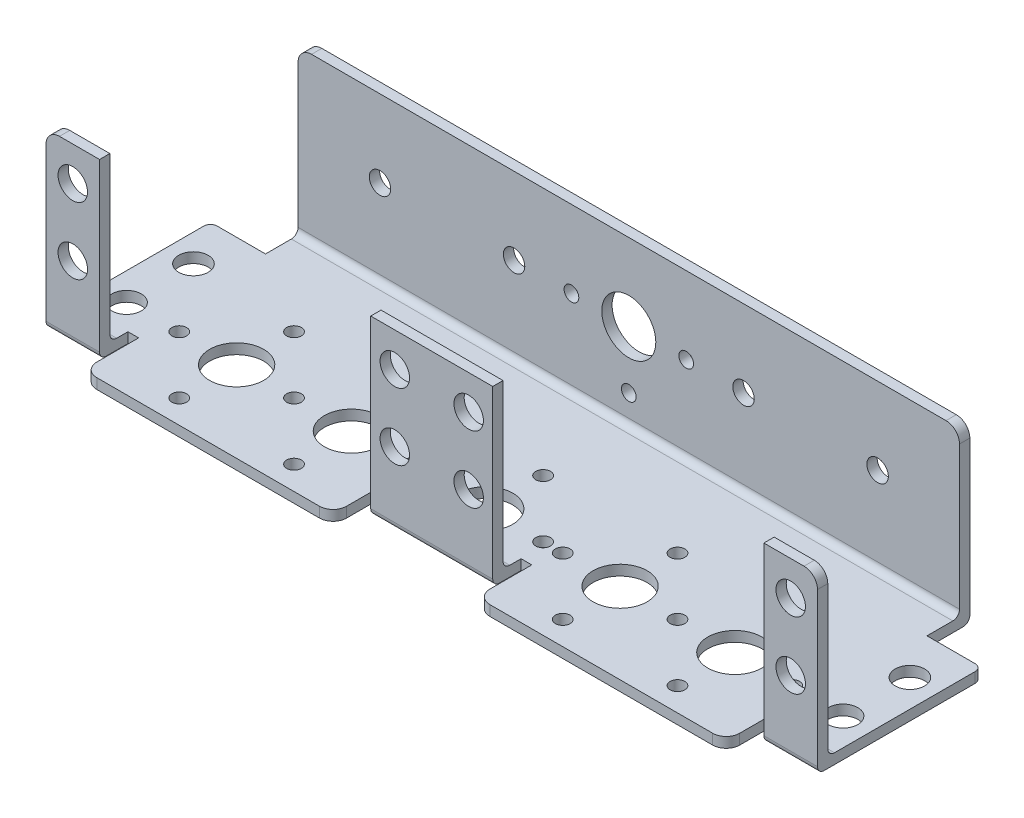
from build123d import *

# Parameters (mm, degrees)
SKETCH1_W               = 114.3
SKETCH1_H               = 34.72
BOSS_EXTRUDE1_DEPTH     = 1.524
SKETCH2_R               = 2.184
SKETCH2_W               = 8.15
SKETCH2_H               = 6.35
CUT_EXTRUDE1_DEPTH      = 1.524
SKETCH3_R               = 4
CUT_EXTRUDE2_DEPTH      = 50
SKETCH4_R               = 1.09
CUT_EXTRUDE3_DEPTH      = 50
CIRPATTERN1_COUNT       = 4
MIRROR2_COPY_1_SKETCH_R = 1.09
MIRROR2_COPY_1_DEPTH    = 50
MIRROR2_COPY_2_SKETCH_R = 1.09
MIRROR2_COPY_2_DEPTH    = 50
MIRROR2_COPY_3_SKETCH_R = 1.09
MIRROR2_COPY_3_DEPTH    = 50
SKETCH7_R               = 4
CUT_EXTRUDE4_DEPTH      = 100
SKETCH8_R               = 1.09
CUT_EXTRUDE5_DEPTH      = 100
CIRPATTERN2_COUNT       = 4
MIRROR3_COPY_1_SKETCH_R = 1.09
MIRROR3_COPY_1_DEPTH    = 50
MIRROR3_COPY_2_SKETCH_R = 1.09
MIRROR3_COPY_2_DEPTH    = 50
MIRROR3_COPY_3_SKETCH_R = 1.09
MIRROR3_COPY_3_DEPTH    = 50
MIRROR3_COPY_4_SKETCH_R = 4
MIRROR3_COPY_4_DEPTH    = 50
MIRROR3_COPY_5_SKETCH_R = 1.09
MIRROR3_COPY_5_DEPTH    = 50
MIRROR3_COPY_6_SKETCH_R = 1.09
MIRROR3_COPY_6_DEPTH    = 50
MIRROR3_COPY_7_SKETCH_R = 1.09
MIRROR3_COPY_7_DEPTH    = 50
MIRROR3_COPY_8_SKETCH_R = 1.09
MIRROR3_COPY_8_DEPTH    = 50
SKETCH9_W               = 7.9375
SKETCH9_H               = 1.524
BOSS_EXTRUDE2_DEPTH     = 24.2
SKETCH10_W              = 98
SKETCH10_H              = 1.524
SKETCH10_W_2            = 18.075
BOSS_EXTRUDE3_DEPTH     = 24.2
SKETCH11_R              = 2.1844
CUT_EXTRUDE6_DEPTH      = 24.2
SKETCH12_R              = 2.1844
CUT_EXTRUDE8_DEPTH      = 24.2
FILLET1_R               = 1
SKETCH13_R              = 1.5875
CUT_EXTRUDE9_DEPTH      = 24.2
FILLET2_R               = 2
SKETCH14_R              = 4
CUT_EXTRUDE10_DEPTH     = 24.2
SKETCH15_R              = 1.09
CUT_EXTRUDE11_DEPTH     = 24.2
CIRPATTERN3_COUNT       = 4


with BuildPart() as part:
    # Sketch1 → Boss-Extrude1 (new body)
    with BuildSketch(Plane(origin=(0, 0, 0), x_dir=(1, 0, 0), z_dir=(0, 1, 0))):
        Rectangle(SKETCH1_W, SKETCH1_H)
    extrude(amount=BOSS_EXTRUDE1_DEPTH)

    # Sketch2 → Cut-Extrude1 (cut)
    with BuildSketch(Plane(origin=(0, 1.524, 0), x_dir=(1, 0, 0), z_dir=(0, 1, 0))):
        with Locations(Location((-53.075, 4.41, 0), (0, 0, 270))):
            Circle(SKETCH2_R)
        with Locations(Location((-53.075, -5.5, 0), (0, 0, 270))):
            Circle(SKETCH2_R)
        with Locations((-53.075, 14.185)):
            Rectangle(SKETCH2_W, SKETCH2_H)
        Polygon((-57.15, -13.36), (-49.2125, -13.36), (-49.2125, -9.16), (-47.625, -9.16), (-47.625, -13.36), (-47.625, -17.36), (-57.15, -17.36), align=None)
        Polygon((-10.625, -13.36), (-10.625, -9.16), (-9.0375, -9.16), (-9.0375, -13.36), (0, -13.36), (0, -17.36), (-10.625, -17.36), align=None)
    cut_extrude1 = extrude(amount=-CUT_EXTRUDE1_DEPTH, mode=Mode.SUBTRACT)

    # Mirror1: Cut-Extrude1 across plane
    add(cut_extrude1.mirror(Plane(origin=(0, 0, 0), x_dir=(0, 0, 1), z_dir=(1, 0, 0))), mode=Mode.SUBTRACT)

    # Sketch3 → Cut-Extrude2 (cut, symmetric)
    with BuildSketch(Plane(origin=(0, 1.524, 0), x_dir=(1, 0, 0), z_dir=(0, 1, 0))):
        with Locations(Location((-36.9062, -5.36, 0), (0, 0, 90))):
            Circle(SKETCH3_R)
    cut_extrude2 = extrude(amount=CUT_EXTRUDE2_DEPTH, both=True, mode=Mode.SUBTRACT)

    # Sketch4 → Cut-Extrude3 (cut, symmetric)
    with BuildSketch(Plane(origin=(0, 1.524, 0), x_dir=(1, 0, 0), z_dir=(0, 1, 0))):
        with Locations(Location((-36.9062, 3.14, 0), (0, 0, 90))):
            Circle(SKETCH4_R)
    cut_extrude3 = extrude(amount=CUT_EXTRUDE3_DEPTH, both=True, mode=Mode.SUBTRACT)

    # CirPattern1: Cut-Extrude3 ×4 about axis
    cirpattern1_axis = Axis((-36.9062, 0, 5.36), (0, 1, 0))
    for i in range(1, CIRPATTERN1_COUNT):
        add(cut_extrude3.rotate(cirpattern1_axis, i * 360 / CIRPATTERN1_COUNT), mode=Mode.SUBTRACT)

    # Mirror2: Cut-Extrude2, Cut-Extrude3 across plane
    add(cut_extrude2.mirror(Plane.ZY.offset(28.4062)), mode=Mode.SUBTRACT)
    add(cut_extrude3.mirror(Plane.ZY.offset(28.4062)), mode=Mode.SUBTRACT)

    # Mirror2 copy 1 sketch → Mirror2 copy 1 (cut, symmetric)
    with BuildSketch(Plane(origin=(-14.5462, 1.524, -31.5462), x_dir=(0, 0, -1), z_dir=(0, 1, 0))):
        with Locations((-36.9062, -3.14)):
            Circle(MIRROR2_COPY_1_SKETCH_R)
    extrude(amount=MIRROR2_COPY_1_DEPTH, both=True, mode=Mode.SUBTRACT)

    # Mirror2 copy 2 sketch → Mirror2 copy 2 (cut, symmetric)
    with BuildSketch(Plane(origin=(17, 1.524, 10.72), x_dir=(1, 0, 0), z_dir=(0, 1, 0))):
        with Locations((-36.9062, -3.14)):
            Circle(MIRROR2_COPY_2_SKETCH_R)
    extrude(amount=MIRROR2_COPY_2_DEPTH, both=True, mode=Mode.SUBTRACT)

    # Mirror2 copy 3 sketch → Mirror2 copy 3 (cut, symmetric)
    with BuildSketch(Plane(origin=(-25.2662, 1.524, 42.2662), x_dir=(0, 0, 1), z_dir=(0, 1, 0))):
        with Locations((-36.9062, -3.14)):
            Circle(MIRROR2_COPY_3_SKETCH_R)
    extrude(amount=MIRROR2_COPY_3_DEPTH, both=True, mode=Mode.SUBTRACT)

    # Sketch7 → Cut-Extrude4 (cut)
    with BuildSketch(Plane(origin=(0, 1.524, 0), x_dir=(1, 0, 0), z_dir=(0, 1, 0))):
        with Locations(Location((0, -5.36, 0), (0, 0, 270))):
            Circle(SKETCH7_R)
    extrude(amount=-CUT_EXTRUDE4_DEPTH, mode=Mode.SUBTRACT)

    # Sketch8 → Cut-Extrude5 (cut)
    with BuildSketch(Plane(origin=(0, 1.524, 0), x_dir=(1, 0, 0), z_dir=(0, 1, 0))):
        with Locations(Location((0, 3.14, 0), (0, 0, 270))):
            Circle(SKETCH8_R)
    cut_extrude5 = extrude(amount=-CUT_EXTRUDE5_DEPTH, mode=Mode.SUBTRACT)

    # CirPattern2: Cut-Extrude5 ×4 about axis, 1 skipped
    cirpattern2_axis = Axis((0, 0, 5.36), (0, 1, 0))
    add([cut_extrude5.rotate(cirpattern2_axis, i * 360 / CIRPATTERN2_COUNT) for i in range(1, CIRPATTERN2_COUNT) if i not in (2,)], mode=Mode.SUBTRACT)

    # Mirror3: Cut-Extrude2, Cut-Extrude3 across plane
    add(cut_extrude2.mirror(Plane(origin=(0, 0, 0), x_dir=(0, 0, 1), z_dir=(1, 0, 0))), mode=Mode.SUBTRACT)
    add(cut_extrude3.mirror(Plane(origin=(0, 0, 0), x_dir=(0, 0, 1), z_dir=(1, 0, 0))), mode=Mode.SUBTRACT)

    # Mirror3 copy 1 sketch → Mirror3 copy 1 (cut, symmetric)
    with BuildSketch(Plane(origin=(42.2662, 1.524, -31.5462), x_dir=(0, 0, -1), z_dir=(0, 1, 0))):
        with Locations((-36.9062, -3.14)):
            Circle(MIRROR3_COPY_1_SKETCH_R)
    extrude(amount=MIRROR3_COPY_1_DEPTH, both=True, mode=Mode.SUBTRACT)

    # Mirror3 copy 2 sketch → Mirror3 copy 2 (cut, symmetric)
    with BuildSketch(Plane(origin=(73.8124, 1.524, 10.72), x_dir=(1, 0, 0), z_dir=(0, 1, 0))):
        with Locations((-36.9062, -3.14)):
            Circle(MIRROR3_COPY_2_SKETCH_R)
    extrude(amount=MIRROR3_COPY_2_DEPTH, both=True, mode=Mode.SUBTRACT)

    # Mirror3 copy 3 sketch → Mirror3 copy 3 (cut, symmetric)
    with BuildSketch(Plane(origin=(31.5462, 1.524, 42.2662), x_dir=(0, 0, 1), z_dir=(0, 1, 0))):
        with Locations((-36.9062, -3.14)):
            Circle(MIRROR3_COPY_3_SKETCH_R)
    extrude(amount=MIRROR3_COPY_3_DEPTH, both=True, mode=Mode.SUBTRACT)

    # Mirror3 copy 4 sketch → Mirror3 copy 4 (cut, symmetric)
    with BuildSketch(Plane(origin=(56.8124, 1.524, 0), x_dir=(1, 0, 0), z_dir=(0, 1, 0))):
        with Locations(Location((-36.9062, -5.36, 0), (0, 0, 90))):
            Circle(MIRROR3_COPY_4_SKETCH_R)
    extrude(amount=MIRROR3_COPY_4_DEPTH, both=True, mode=Mode.SUBTRACT)

    # Mirror3 copy 5 sketch → Mirror3 copy 5 (cut, symmetric)
    with BuildSketch(Plane(origin=(56.8124, 1.524, 0), x_dir=(1, 0, 0), z_dir=(0, 1, 0))):
        with Locations(Location((-36.9062, 3.14, 0), (0, 0, 90))):
            Circle(MIRROR3_COPY_5_SKETCH_R)
    extrude(amount=MIRROR3_COPY_5_DEPTH, both=True, mode=Mode.SUBTRACT)

    # Mirror3 copy 6 sketch → Mirror3 copy 6 (cut, symmetric)
    with BuildSketch(Plane(origin=(14.5462, 1.524, -31.5462), x_dir=(0, 0, -1), z_dir=(0, 1, 0))):
        with Locations(Location((-36.9062, 3.14, 0), (0, 0, 90))):
            Circle(MIRROR3_COPY_6_SKETCH_R)
    extrude(amount=MIRROR3_COPY_6_DEPTH, both=True, mode=Mode.SUBTRACT)

    # Mirror3 copy 7 sketch → Mirror3 copy 7 (cut, symmetric)
    with BuildSketch(Plane(origin=(-17, 1.524, 10.72), x_dir=(-1, 0, 0), z_dir=(0, 1, 0))):
        with Locations(Location((-36.9062, 3.14, 0), (0, 0, 90))):
            Circle(MIRROR3_COPY_7_SKETCH_R)
    extrude(amount=MIRROR3_COPY_7_DEPTH, both=True, mode=Mode.SUBTRACT)

    # Mirror3 copy 8 sketch → Mirror3 copy 8 (cut, symmetric)
    with BuildSketch(Plane(origin=(25.2662, 1.524, 42.2662), x_dir=(0, 0, 1), z_dir=(0, 1, 0))):
        with Locations(Location((-36.9062, 3.14, 0), (0, 0, 90))):
            Circle(MIRROR3_COPY_8_SKETCH_R)
    extrude(amount=MIRROR3_COPY_8_DEPTH, both=True, mode=Mode.SUBTRACT)

    # Sketch9 → Boss-Extrude2 (add)
    with BuildSketch(Plane(origin=(0, 1.524, 0), x_dir=(1, 0, 0), z_dir=(0, 1, 0))):
        with Locations((-53.18125, -12.598)):
            Rectangle(SKETCH9_W, SKETCH9_H)
    boss_extrude2 = extrude(amount=BOSS_EXTRUDE2_DEPTH)

    # Mirror4: Boss-Extrude2 across plane
    add(boss_extrude2.mirror(Plane(origin=(0, 0, 0), x_dir=(0, 0, 1), z_dir=(1, 0, 0))))

    # Sketch10 → Boss-Extrude3 (add)
    with BuildSketch(Plane(origin=(0, 1.524, 0), x_dir=(1, 0, 0), z_dir=(0, 1, 0))):
        with Locations((0, 16.598)):
            Rectangle(SKETCH10_W, SKETCH10_H)
        with Locations((0, -12.598)):
            Rectangle(SKETCH10_W_2, SKETCH10_H)
    extrude(amount=BOSS_EXTRUDE3_DEPTH)

    # Sketch11 → Cut-Extrude6 (cut)
    with BuildSketch(Plane.XY.offset(13.36)):
        with Locations((-53.18125, 20.644)):
            Circle(SKETCH11_R)
        with Locations((-53.18125, 10.734)):
            Circle(SKETCH11_R)
    cut_extrude6 = extrude(amount=-CUT_EXTRUDE6_DEPTH, mode=Mode.SUBTRACT)

    # Mirror5: Cut-Extrude6 across plane
    add(cut_extrude6.mirror(Plane(origin=(0, 0, 0), x_dir=(0, 0, 1), z_dir=(1, 0, 0))), mode=Mode.SUBTRACT)

    # Sketch12 → Cut-Extrude8 (cut)
    with BuildSketch(Plane.XY.offset(13.36)):
        with Locations((-5.47125, 20.644)):
            Circle(SKETCH12_R)
        with Locations((-5.47125, 10.734)):
            Circle(SKETCH12_R)
        with Locations((5.47125, 10.734)):
            Circle(SKETCH12_R)
        with Locations((5.47125, 20.644)):
            Circle(SKETCH12_R)
    extrude(amount=-CUT_EXTRUDE8_DEPTH, mode=Mode.SUBTRACT)

    # Fillet1
    fillet1_edges = [part.edges().sort_by_distance(p)[0] for p in [
        (53.18125, 0, 13.36),
        (-53.18125, 1.524, 11.836),
        (53.18125, 1.524, 11.836),
        (-57.15, 0.762, -11.01),
        (0, 1.524, -15.836),
        (0, 1.524, 11.836),
        (-53.18125, 0, 13.36),
        (0, 0, 13.36),
        (0, 0, -17.36),
        (57.15, 0.762, -11.01),
    ]]
    fillet(fillet1_edges, radius=FILLET1_R)

    # Sketch13 → Cut-Extrude9 (cut)
    with BuildSketch(Plane.XY.offset(-15.836)):
        with Locations((36.8628, 14.2875)):
            Circle(SKETCH13_R)
        with Locations((17, 14.2875)):
            Circle(SKETCH13_R)
    cut_extrude9 = extrude(amount=-CUT_EXTRUDE9_DEPTH, mode=Mode.SUBTRACT)

    # Mirror6: Cut-Extrude9 across plane
    add(cut_extrude9.mirror(Plane(origin=(0, 0, 0), x_dir=(0, 0, 1), z_dir=(1, 0, 0))), mode=Mode.SUBTRACT)

    # Fillet2
    fillet2_edges = [part.edges().sort_by_distance(p)[0] for p in [
        (47.625, 0.762, 17.36),
        (10.625, 0.762, 17.36),
        (-57.15, 25.724, 12.598),
        (57.15, 25.724, 12.598),
        (-49, 25.724, -16.598),
        (49, 25.724, -16.598),
        (-47.625, 0.762, 17.36),
        (-10.625, 0.762, 17.36),
    ]]
    fillet(fillet2_edges, radius=FILLET2_R)

    # Sketch14 → Cut-Extrude10 (cut)
    with BuildSketch(Plane.XY.offset(-15.836)):
        with Locations((0, 14.2875)):
            Circle(SKETCH14_R)
    extrude(amount=-CUT_EXTRUDE10_DEPTH, mode=Mode.SUBTRACT)

    # Sketch15 → Cut-Extrude11 (cut)
    with BuildSketch(Plane.XY.offset(-15.836)):
        with Locations((0, 5.7875)):
            Circle(SKETCH15_R)
    cut_extrude11 = extrude(amount=-CUT_EXTRUDE11_DEPTH, mode=Mode.SUBTRACT)

    # CirPattern3: Cut-Extrude11 ×4 about axis, 1 skipped
    cirpattern3_axis = Axis((0, 14.2875, 0), (0, 0, 1))
    add([cut_extrude11.rotate(cirpattern3_axis, i * 360 / CIRPATTERN3_COUNT) for i in range(1, CIRPATTERN3_COUNT) if i not in (2,)], mode=Mode.SUBTRACT)


solid = part.part
